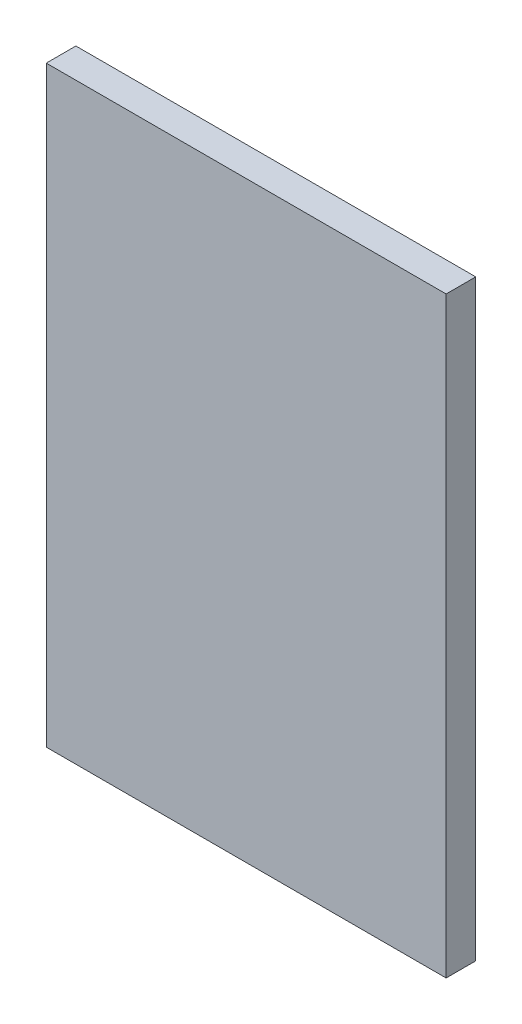
from build123d import *

# Parameters (mm, degrees)
SKCAJASUJETADORASUR_W   = 270
SKCAJASUJETADORASUR_H   = 20
CAJASUJETADORASUR_DEPTH = 400


with BuildPart() as part:
    # SkCajaSujetadoraSur → CajaSujetadoraSur (new body)
    with BuildSketch(Plane(origin=(0, 630, 0), x_dir=(1, 0, 0), z_dir=(0, 1, 0))):
        with Locations((0, 145)):
            Rectangle(SKCAJASUJETADORASUR_W, SKCAJASUJETADORASUR_H)
    extrude(amount=CAJASUJETADORASUR_DEPTH)


solid = part.part
